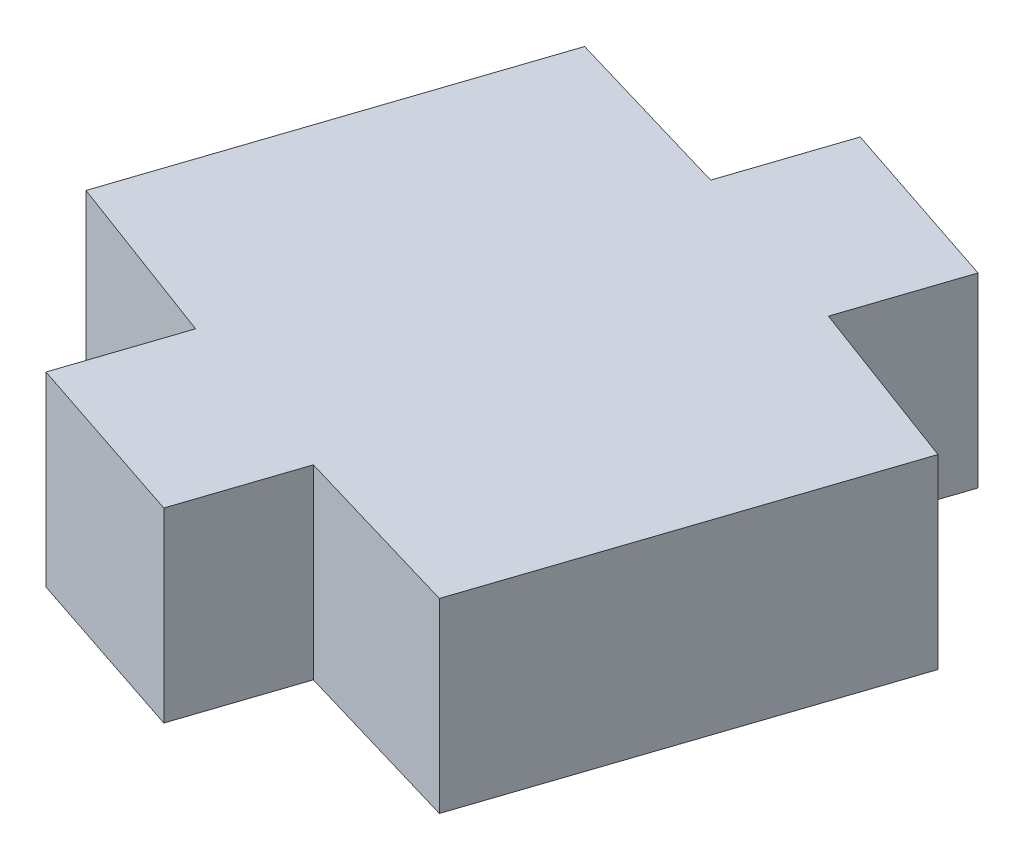
from build123d import *

# Parameters (mm, degrees)
BOSS_EXTRUDE1_DEPTH = 3


with BuildPart() as part:
    # Sketch1 → Boss-Extrude1 (new, symmetric)
    with BuildSketch(Plane(origin=(0, 228.6, 0), x_dir=(1, 0, 0), z_dir=(0, 1, 0))):
        Polygon((-41.278089048, 57.178899874), (-46.970188837, 59.07626647), (-48.175016625, 55.461783105), (-53.933373915, 57.160377196), (-57.949466544, 45.112099311), (-52.323624257, 43.01596021), (-53.528452045, 39.401476845), (-47.836352257, 37.504110248), (-46.631524468, 41.118593614), (-40.873167179, 39.419999523), (-36.85707455, 51.468277408), (-42.482916837, 53.564416509), align=None)
    extrude(amount=BOSS_EXTRUDE1_DEPTH, both=True)


solid = part.part
